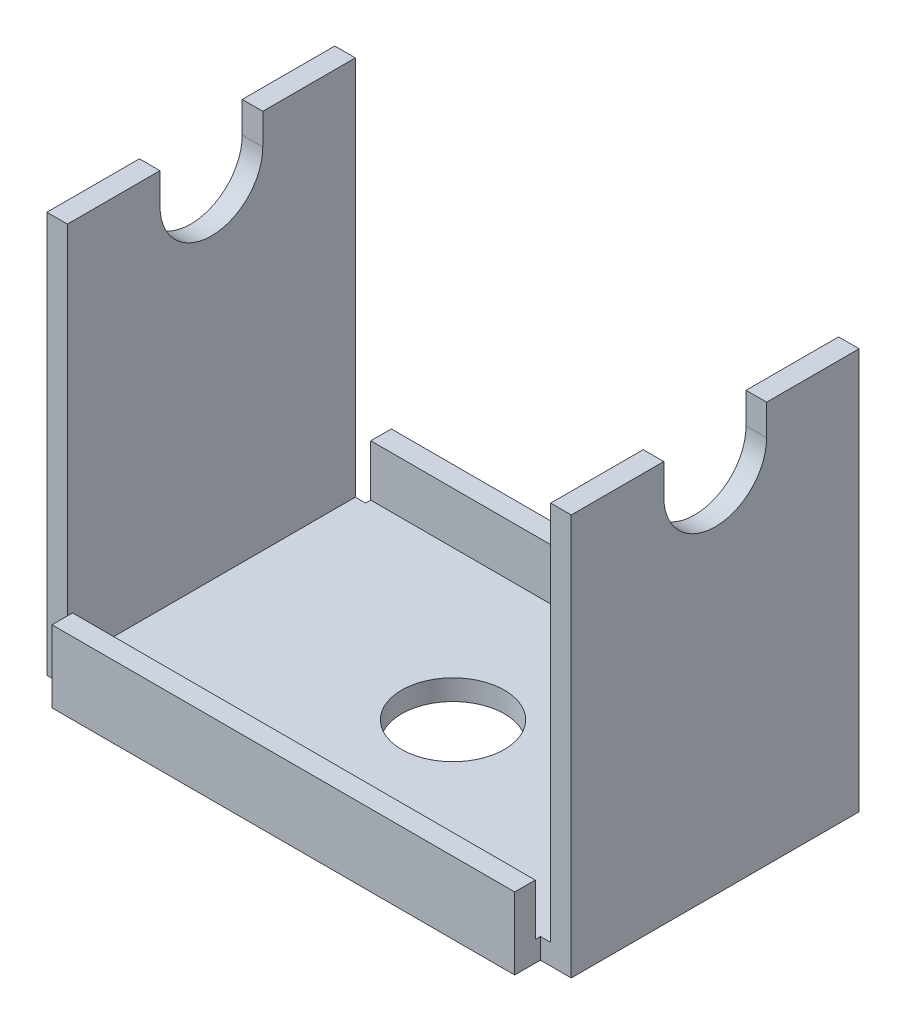
from build123d import *

# Parameters (mm, degrees)
BOSS_EXTRUDE1_DEPTH = 14
BOSS_EXTRUDE2_DEPTH = 22.5
CUT_EXTRUDE1_DEPTH  = 67.289139382
SKETCH4_R           = 5
CUT_EXTRUDE2_DEPTH  = 48.86961458


with BuildPart() as part:
    # Sketch1 → Boss-Extrude1 (new, symmetric)
    with BuildSketch(Plane.XY):
        Polygon((-25.5, 39), (-25.5, 0), (25.5, 0), (25.5, 39), (23.5, 39), (23.5, 2), (-23.5, 2), (-23.5, 39), align=None)
    extrude(amount=BOSS_EXTRUDE1_DEPTH, both=True)

    # Sketch2 → Boss-Extrude2 (add, symmetric)
    with BuildSketch(Plane(origin=(0, 0, 0), x_dir=(0, 0, -1), z_dir=(1, 0, 0))):
        Polygon((-14, 0), (-16.5, 0), (-16.5, 7), (-14.5, 7), (-14.5, 2), (-14, 2), align=None)
    boss_extrude2 = extrude(amount=BOSS_EXTRUDE2_DEPTH, both=True)

    # Mirror1: Boss-Extrude2 across plane
    add(boss_extrude2.mirror(Plane.XY))

    # Sketch3 → Cut-Extrude1 (cut, through all)
    with BuildSketch(Plane(origin=(25.5, 0, 0), x_dir=(0, 0, -1), z_dir=(1, 0, 0))):
        with BuildLine():
            Line((-5, 36), (-5, 39))
            Line((-5, 39), (5, 39))
            Line((5, 39), (5, 36))
            ThreePointArc((5, 36), (0, 31), (-5, 36))
        make_face()
    extrude(amount=-CUT_EXTRUDE1_DEPTH, mode=Mode.SUBTRACT)

    # Sketch4 → Cut-Extrude2 (cut, through all)
    with BuildSketch(Plane(origin=(0, 2, 0), x_dir=(1, 0, 0), z_dir=(0, 1, 0))):
        with Locations(Location((0, 0, 0), (0, 0, 270))):
            Circle(SKETCH4_R)
    extrude(amount=-CUT_EXTRUDE2_DEPTH, mode=Mode.SUBTRACT)


solid = part.part
